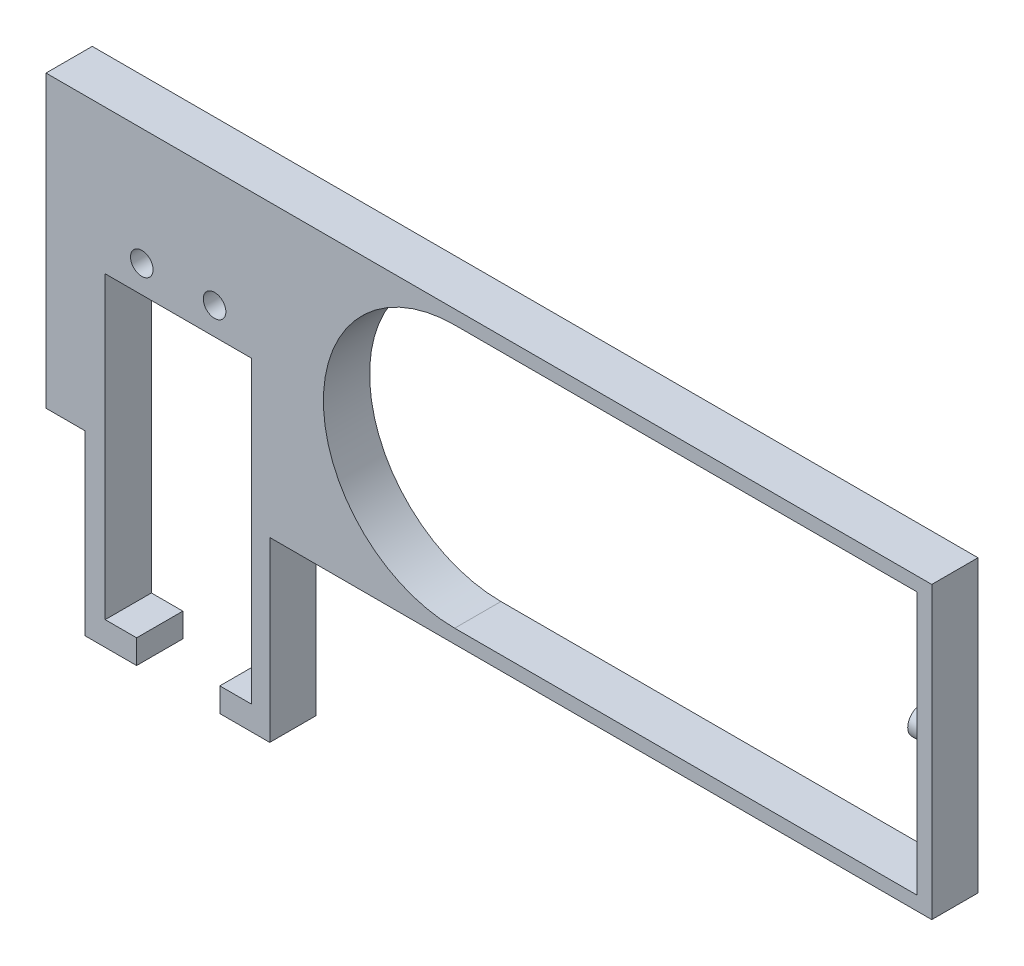
from build123d import *

# Parameters (mm, degrees)
SKETCH1_R                = 19.939
CIRCLE_EXTRUDE_DEPTH     = 6.35
SKETCH3_W                = 6.35
SKETCH3_H                = 39.878
RECTANGLE_EXTRUDE_DEPTH  = 127
SKETCH2_R                = 18.034
CIRCLE_CUT_DEPTH         = 129.712416732
SKETCH6_W                = 125.095
SKETCH6_H                = 36.068
RECTANGLE_CUT_DEPTH      = 129.712416732
SKETCH7_W                = 61.595
SKETCH7_H                = 36.068
END_SHAPE_DEPTH          = 6.35
SKETCH8_R                = 1.905
FOR_SPRING_EXTRUDE_DEPTH = 2.54
MIRRORED_PATTERN_COUNT   = 2
MIRRORED_PATTERN_PITCH   = 254
MIDDLE_CONNECTOR_REACH   = 256.861
SKETCH10_W               = 6.35
SKETCH10_H               = 39.878
SKETCH11_W               = 6.35
SKETCH11_H               = 39.878
END_CUT_DEPTH            = 55.88
SKETCH13_W               = 25.4
SKETCH13_H               = 44.45
BOSS_EXTRUDE1_DEPTH      = 6.35
SKETCH12_W               = 20.066
SKETCH12_H               = 41.148
CUT_EXTRUDE1_DEPTH       = 329.188764629
LPATTERN1_COUNT          = 2
LPATTERN1_PITCH          = 107.188
SKETCH14_R               = 1.55
CUT_EXTRUDE2_DEPTH       = 329.188764629
SKETCH16_W               = 11.43
SKETCH16_H               = 3.302
CUT_EXTRUDE4_DEPTH       = 329.188764629
SKETCH17_W               = 244.663086165
SKETCH17_H               = 85.398325617
SKETCH17_W_2             = 5.588
SKETCH17_H_2             = 39.878
CUT_EXTRUDE5_DEPTH       = 329.188764629


with BuildPart() as part:
    # Sketch1 → circle extrude (new body)
    with BuildSketch(Plane.XY):
        Circle(SKETCH1_R)
    extrude(amount=CIRCLE_EXTRUDE_DEPTH)

    # Sketch3 → rectangle extrude (add)
    with BuildSketch(Plane(origin=(0, 0, 0), x_dir=(0, 0, -1), z_dir=(1, 0, 0))):
        with Locations((-3.175, 0)):
            Rectangle(SKETCH3_W, SKETCH3_H)
    extrude(amount=RECTANGLE_EXTRUDE_DEPTH)

    # Sketch2 → circle cut (cut, through all)
    with BuildSketch(Plane.XY.offset(6.35)):
        Circle(SKETCH2_R)
    extrude(amount=-CIRCLE_CUT_DEPTH, mode=Mode.SUBTRACT)

    # Sketch6 → rectangle cut (cut, through all)
    with BuildSketch(Plane.XY.offset(6.35)):
        with Locations((62.5475, 0)):
            Rectangle(SKETCH6_W, SKETCH6_H)
    extrude(amount=-RECTANGLE_CUT_DEPTH, mode=Mode.SUBTRACT)

    # Sketch7 → end shape (add)
    with BuildSketch(Plane.XY.offset(6.35)):
        with Locations((94.2975, 0)):
            Rectangle(SKETCH7_W, SKETCH7_H)
    extrude(amount=-END_SHAPE_DEPTH)

    # Sketch8 → for spring extrude (add)
    with BuildSketch(Plane.ZY.offset(-63.5)):
        with Locations((3.175, 0)):
            Circle(SKETCH8_R)
    extrude(amount=FOR_SPRING_EXTRUDE_DEPTH)


with BuildPart() as mirrored_pattern_1:
    # mirrored pattern: pattern copy
    add(part.part.moved(Location(Vector(1, 0, 0) * (1 * MIRRORED_PATTERN_PITCH))))

    # Sketch10 → middle connector (add, up to next)
    with BuildSketch(Plane(origin=(127, 0, 0), x_dir=(0, 0, -1), z_dir=(1, 0, 0)), mode=Mode.PRIVATE) as middle_connector_sk1:
        with Locations((-3.175, 0)):
            Rectangle(SKETCH10_W, SKETCH10_H)
    middle_connector_tool1 = extrude(middle_connector_sk1.sketch, amount=MIDDLE_CONNECTOR_REACH, mode=Mode.PRIVATE) - mirrored_pattern_1.part

    add(part.part)  # middle connector merges part
    add(middle_connector_tool1.solids().sort_by_distance((127, 0, 3.175))[0])

    # Sketch11 → end cut (cut)
    with BuildSketch(Plane(origin=(381, 0, 0), x_dir=(0, 0, -1), z_dir=(1, 0, 0))):
        with Locations((-3.175, 0)):
            Rectangle(SKETCH11_W, SKETCH11_H)
    extrude(amount=-END_CUT_DEPTH, mode=Mode.SUBTRACT)

    # Sketch13 → Boss-Extrude1 (add)
    with BuildSketch(Plane.XY.offset(6.35)):
        with Locations((215.9, -22.098)):
            Rectangle(SKETCH13_W, SKETCH13_H)
    boss_extrude1 = extrude(amount=-BOSS_EXTRUDE1_DEPTH)

    # Sketch12 → Cut-Extrude1 (cut, through all)
    with BuildSketch(Plane.XY.offset(6.35)):
        with Locations((216.027, -20.447)):
            Rectangle(SKETCH12_W, SKETCH12_H)
    cut_extrude1 = extrude(amount=-CUT_EXTRUDE1_DEPTH, mode=Mode.SUBTRACT)

    # LPattern1: Boss-Extrude1, Cut-Extrude1 ×2
    with Locations(*[(-i * LPATTERN1_PITCH, 0, 0) for i in range(1, LPATTERN1_COUNT)]):
        add(boss_extrude1)
        add(cut_extrude1, mode=Mode.SUBTRACT)

    # Sketch14 → Cut-Extrude2 (cut, through all)
    with BuildSketch(Plane(origin=(0, 0, 0), x_dir=(-1, 0, 0), z_dir=(0, 0, -1))):
        with Locations((-103.96, 3.88)):
            Circle(SKETCH14_R)
        with Locations((-113.96, 3.88)):
            Circle(SKETCH14_R)
        with Locations((-211.021, 3.88)):
            Circle(SKETCH14_R)
        with Locations((-221.021, 3.88)):
            Circle(SKETCH14_R)
    extrude(amount=-CUT_EXTRUDE2_DEPTH, mode=Mode.SUBTRACT)

    # Sketch16 → Cut-Extrude4 (cut, through all)
    with BuildSketch(Plane.XY.offset(6.35)):
        with Locations((216.027, -42.672)):
            Rectangle(SKETCH16_W, SKETCH16_H)
    extrude(amount=-CUT_EXTRUDE4_DEPTH, mode=Mode.SUBTRACT)

    # Sketch17 → Cut-Extrude5 (cut, through all)
    with BuildSketch(Plane.XY.offset(6.35)):
        with Locations((75.534456918, -9.69861823)):
            Rectangle(SKETCH17_W, SKETCH17_H)
        with Locations((322.326, 0)):
            Rectangle(SKETCH17_W_2, SKETCH17_H_2)
    extrude(amount=-CUT_EXTRUDE5_DEPTH, mode=Mode.SUBTRACT)


solid = mirrored_pattern_1.part
